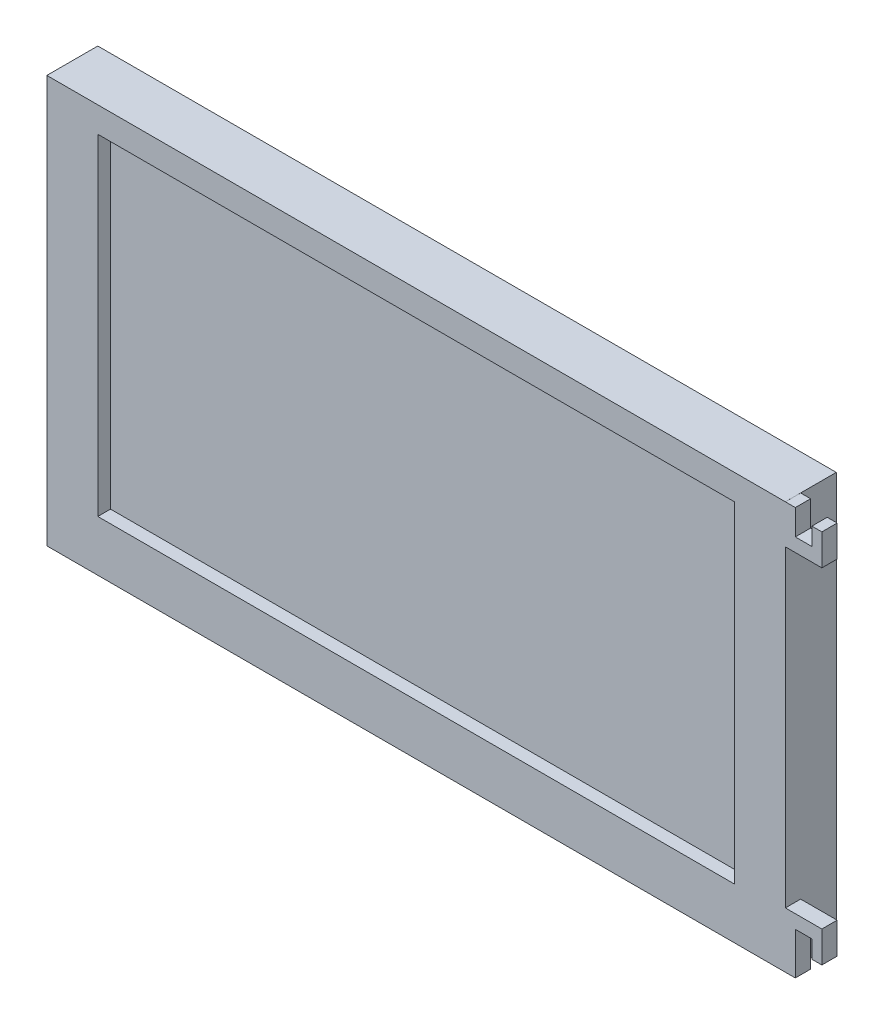
from build123d import *

# Parameters (mm, degrees)
SKETCH1_W           = 368.3
SKETCH1_H           = 203.2
BOSS_EXTRUDE1_DEPTH = 12.7
SKETCH2_W           = 317.5
SKETCH2_H           = 165.1
CUT_EXTRUDE1_DEPTH  = 6.35
BOSS_EXTRUDE3_DEPTH = 7.62


with BuildPart() as part:
    # Sketch1 → Boss-Extrude1 (new, symmetric)
    with BuildSketch(Plane.XY):
        Rectangle(SKETCH1_W, SKETCH1_H)
    extrude(amount=BOSS_EXTRUDE1_DEPTH, both=True)

    # Sketch2 → Cut-Extrude1 (cut)
    with BuildSketch(Plane.XY.offset(12.7)):
        with Locations((0, 6.35)):
            Rectangle(SKETCH2_W, SKETCH2_H)
    extrude(amount=-CUT_EXTRUDE1_DEPTH, mode=Mode.SUBTRACT)

    # Sketch4 → Boss-Extrude3 (add)
    with BuildSketch(Plane.XY.offset(12.7)):
        Polygon((184.15, -101.6), (189.119700693, -101.6), (189.119700693, -80.560215749), (197.392455233, -80.560215749), (197.392455233, -89.3698935), (202.362155926, -89.3698935), (202.362155926, -73.820655617), (184.15, -73.820655617), align=None)
        Polygon((189.119700693, 88.9), (197.392455233, 88.9), (197.392455233, 97.709677751), (202.362155926, 97.709677751), (202.362155926, 82.160439868), (184.15, 82.160439868), (184.15, 88.012590692), (184.15, 101.584884773), (189.119700693, 101.584884773), align=None)
    extrude(amount=-BOSS_EXTRUDE3_DEPTH)


solid = part.part
